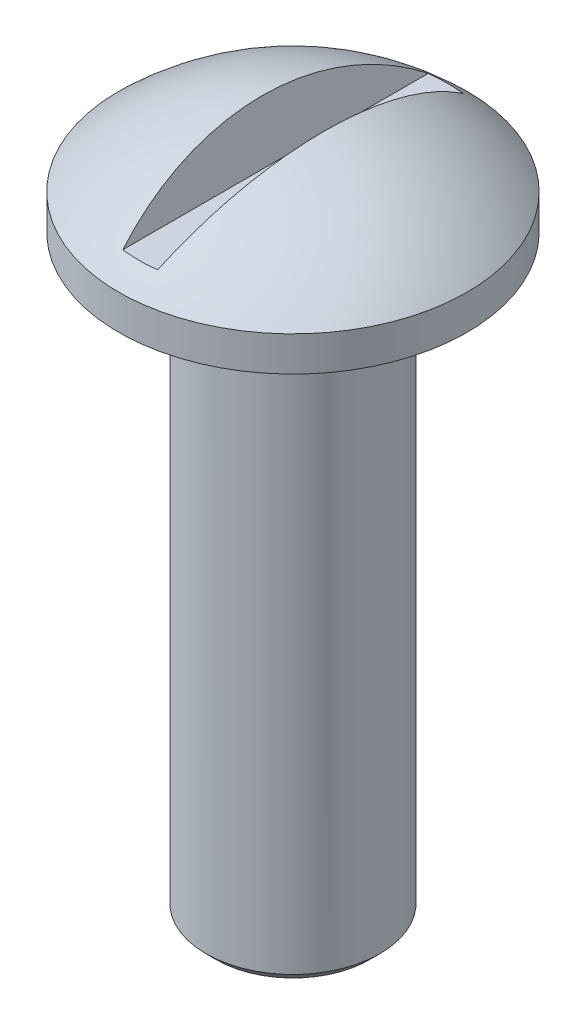
from build123d import *

# Parameters (mm, degrees)
DOME2_FACE_RADIUS       = 12.7
DOME2_HEIGHT            = 5.08
CUT_EXTRUDE2_DEPTH      = 54.881536726
CUT_EXTRUDE2_DEPTH_BACK = 54.881536726
CHAMFER1_SIZE           = 0.762


with BuildPart() as part:
    # Sketch1 → Revolve1 (revolve)
    with BuildSketch(Plane.XY, mode=Mode.PRIVATE) as revolve1_sk:
        Polygon((0, 0), (0, 45.72), (-12.7, 45.72), (-12.7, 43.18), (-6.35, 43.18), (-6.35, 0), align=None)
    revolve(revolve1_sk.sketch.rotate(Axis((0, 0, 0), (0, 1, 0)), 270), axis=Axis((0, 0, 0), (0, 1, 0)))

    # Dome2: a dome of height H over a round flat face of radius A is a cap of a sphere of radius (A * A + H * H) / (2 * H)
    dome2_r = (DOME2_FACE_RADIUS * DOME2_FACE_RADIUS + DOME2_HEIGHT * DOME2_HEIGHT) / (2 * DOME2_HEIGHT)
    dome2_base = Plane((0, 45.72, 0), z_dir=(0, 1, 0))
    with Locations(dome2_base.offset(DOME2_HEIGHT - dome2_r)):
        dome2_ball = Sphere(dome2_r, mode=Mode.PRIVATE)
    add(split(dome2_ball, bisect_by=dome2_base, keep=Keep.TOP, mode=Mode.PRIVATE))

    # Sketch2 → Cut-Extrude2 (cut, two sides: drawn at the far end of the back side and taken through both)
    with BuildSketch(Plane.XY.offset(-CUT_EXTRUDE2_DEPTH_BACK)):
        Polygon((1.27, 46.99), (-1.27, 46.99), (-3.262213041, 54.425040289), (3.262213041, 54.425040289), align=None)
    extrude(amount=CUT_EXTRUDE2_DEPTH + CUT_EXTRUDE2_DEPTH_BACK, mode=Mode.SUBTRACT)

    # Chamfer1
    chamfer1_edges = [part.edges().sort_by_distance(p)[0] for p in [
        (0, 0, 6.35),
    ]]
    chamfer(chamfer1_edges, length=CHAMFER1_SIZE)


solid = part.part
